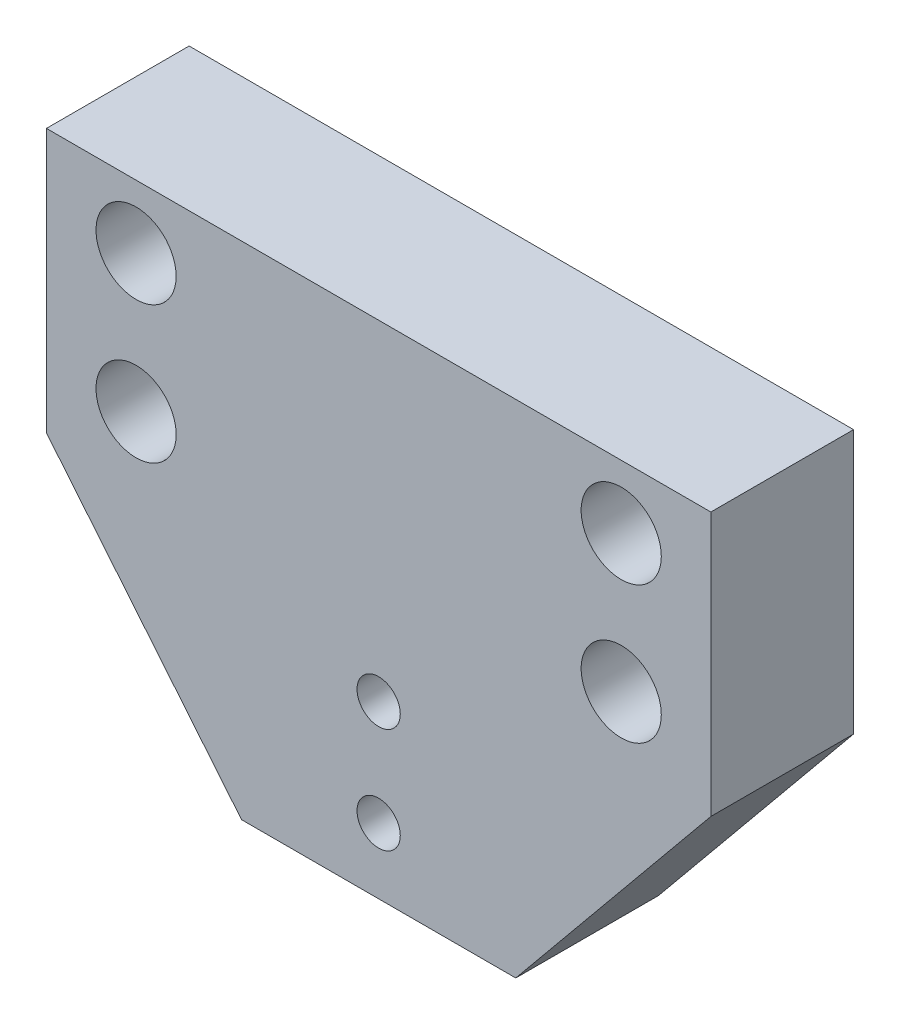
from build123d import *

# Parameters (mm, degrees)
SKETCH1_W           = 63
SKETCH1_H           = 25
SKETCH1_R           = 3.8
BOSS_EXTRUDE1_DEPTH = 13.53
SKETCH1_3_R         = 2.05
BOSS_EXTRUDE2_DEPTH = 13.53


with BuildPart() as part:
    # Sketch1 → Boss-Extrude1 (new body)
    with BuildSketch(Plane.XY):
        with Locations((0, -2.5)):
            Rectangle(SKETCH1_W, SKETCH1_H)
        with Locations((-23, -9)):
            Circle(SKETCH1_R, mode=Mode.SUBTRACT)
        with Locations((-23, 4)):
            Circle(SKETCH1_R, mode=Mode.SUBTRACT)
        with Locations((23, -9)):
            Circle(SKETCH1_R, mode=Mode.SUBTRACT)
        with Locations((23, 4)):
            Circle(SKETCH1_R, mode=Mode.SUBTRACT)
    extrude(amount=BOSS_EXTRUDE1_DEPTH)

    # Sketch1<3> → Boss-Extrude2 (add)
    with BuildSketch(Plane.XY):
        Polygon((13, -37.51566868), (31.5, -15), (-31.5, -15), (-13, -37.51566868), (0, -37.51566868), align=None)
        with Locations((0, -31.299955557)):
            Circle(SKETCH1_3_R, mode=Mode.SUBTRACT)
        with Locations((0, -21.322069584)):
            Circle(SKETCH1_3_R, mode=Mode.SUBTRACT)
    extrude(amount=BOSS_EXTRUDE2_DEPTH)


solid = part.part
